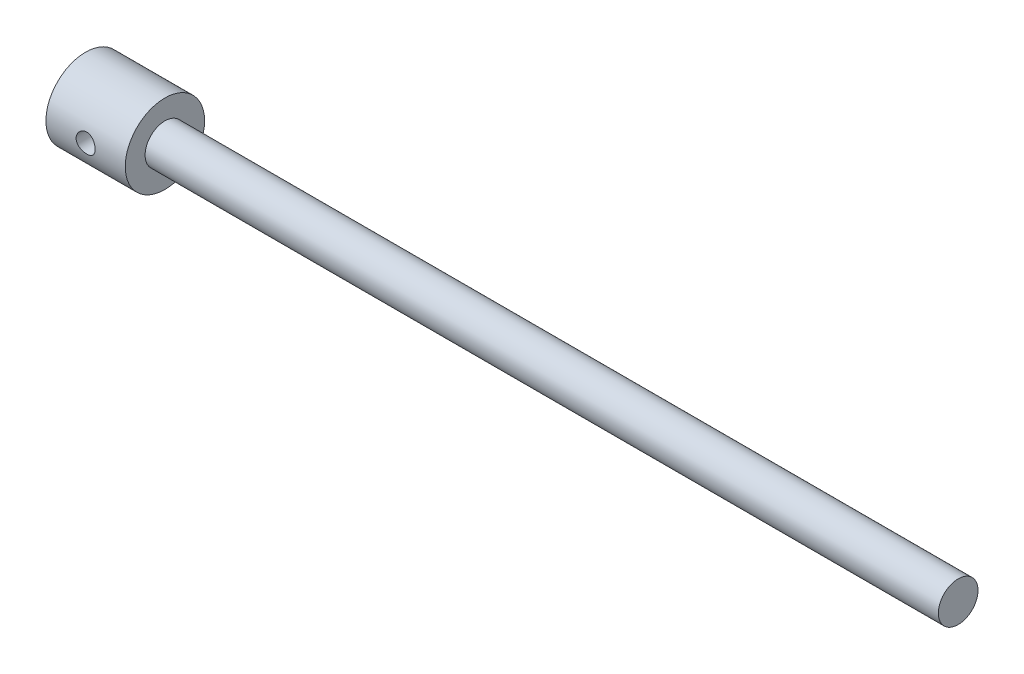
from build123d import *

# Parameters (mm, degrees)
SZKIC1_R                    = 25
DODANIE_WYCI_GNI_CIE1_DEPTH = 50
SZKIC2_R                    = 6
WYTNIJ_WYCI_GNI_CIE2_DEPTH  = 45
SZKIC3_R                    = 12.5
DODANIE_WYCI_GNI_CIE2_DEPTH = 500


with BuildPart() as part:
    # Szkic1 → Dodanie-wyciągnięcie1 (new body)
    with BuildSketch(Plane(origin=(0, 0, 0), x_dir=(0, 0, -1), z_dir=(1, 0, 0))):
        Circle(SZKIC1_R)
    extrude(amount=DODANIE_WYCI_GNI_CIE1_DEPTH)

    # Szkic2 → Wytnij-wyciągnięcie2 (cut, symmetric)
    with BuildSketch(Plane.XY):
        with Locations((25, 0)):
            Circle(SZKIC2_R)
    extrude(amount=WYTNIJ_WYCI_GNI_CIE2_DEPTH, both=True, mode=Mode.SUBTRACT)

    # Szkic3 → Dodanie-wyciągnięcie2 (add)
    with BuildSketch(Plane(origin=(50, 0, 0), x_dir=(0, 0, -1), z_dir=(1, 0, 0))):
        Circle(SZKIC3_R)
    extrude(amount=DODANIE_WYCI_GNI_CIE2_DEPTH)


solid = part.part
